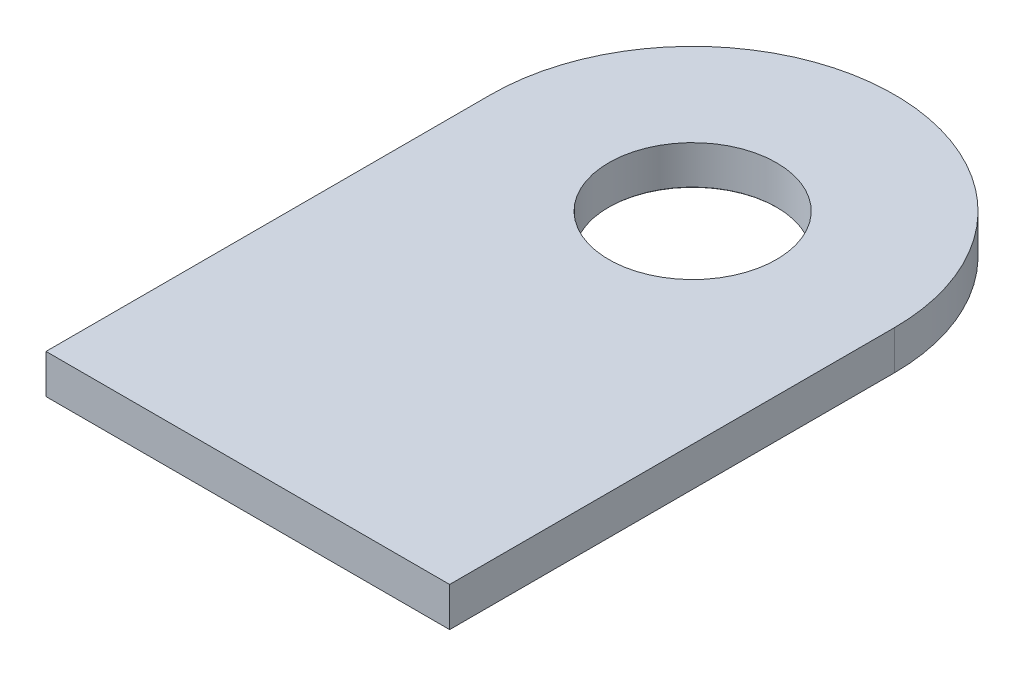
from build123d import *

# Parameters (mm, degrees)
SKETCH1_R           = 7.94
BOSS_EXTRUDE1_DEPTH = 1.54


with BuildPart() as part:
    # Sketch1 → Boss-Extrude1 (new body)
    with BuildSketch(Plane(origin=(0, 0, 0), x_dir=(1, 0, 0), z_dir=(0, 1, 0))):
        Circle(SKETCH1_R)
        with BuildLine():
            ThreePointArc((7.94, 0), (0, -7.94), (-7.94, 0))
            Line((-7.94, 0), (-7.94, -17.5))
            Line((-7.94, -17.5), (7.94, -17.5))
            Line((7.94, -17.5), (7.94, 0))
        make_face()
    extrude(amount=BOSS_EXTRUDE1_DEPTH)

    # Sketch3 → M6 Clearance Hole1 (revolve, cut)
    with BuildSketch(Plane(origin=(0, 0, 0), x_dir=(0, 0, -1), z_dir=(1, 0, 0))):
        Polygon((0, 0), (0, 1.54), (3.3, 1.54), (3.3, 0.025), (3.325, 0), align=None)
    revolve(axis=Axis((0, -6.35, 0), (0, 1, 0)), mode=Mode.SUBTRACT)


solid = part.part
